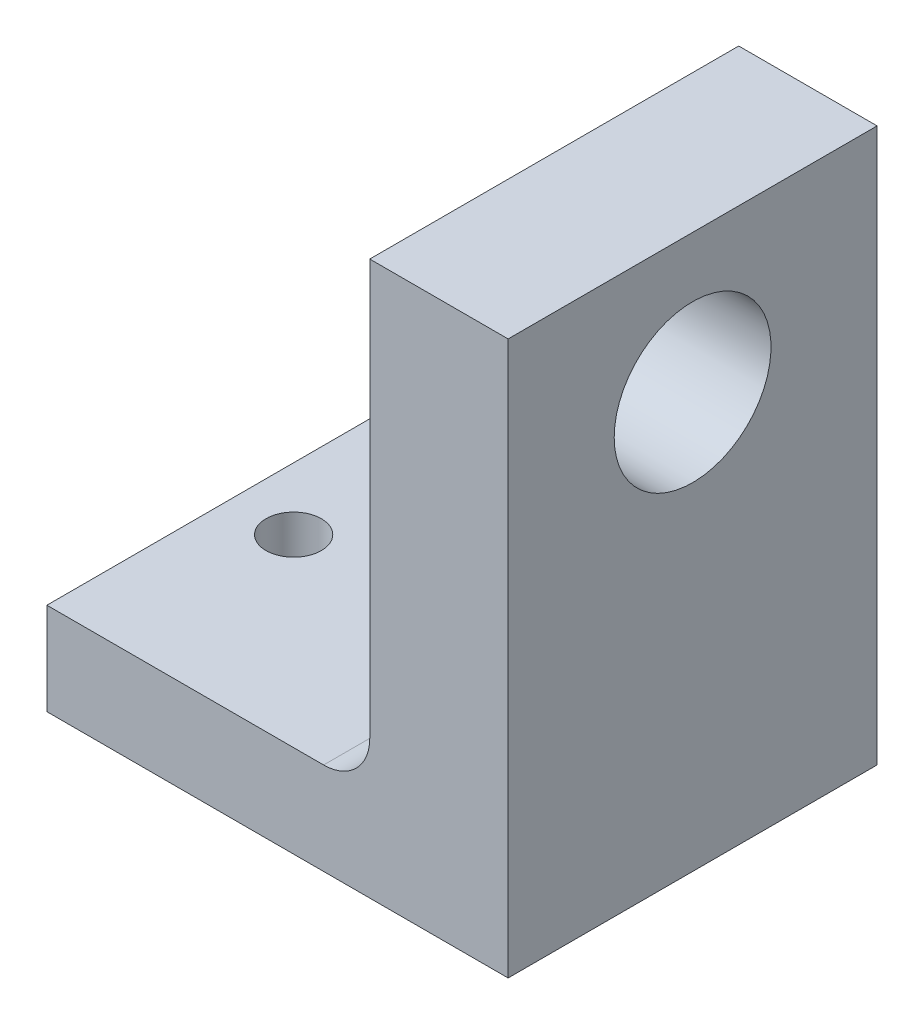
from build123d import *

# Parameters (mm, degrees)
EXTRUDE_1_DEPTH     = 8
SKETCH_2_R          = 0.6
CUT_EXTRUDE_1_DEPTH = 14.747727085
HOLE_WIZARD_M3_1_D  = 3.4
FILLET_1_R          = 1


with BuildPart() as part:
    # ｽｹｯﾁ1 → ﾎﾞｽ - 押し出し1 (new body)
    with BuildSketch(Plane.XY):
        Polygon((-5, -6), (5, -6), (5, 6), (2, 6), (2, -4), (-5, -4), align=None)
    extrude(amount=EXTRUDE_1_DEPTH)

    # ｽｹｯﾁ2 → ｶｯﾄ - 押し出し1 (cut, through all)
    with BuildSketch(Plane(origin=(0, -4, 0), x_dir=(1, 0, 0), z_dir=(0, 1, 0))):
        with Locations(Location((-1.11, -4, 0), (0, 0, 180))):
            Circle(SKETCH_2_R)
        with Locations(Location((-3.65, -4, 0), (0, 0, 180))):
            Circle(SKETCH_2_R)
    extrude(amount=-CUT_EXTRUDE_1_DEPTH, mode=Mode.SUBTRACT)

    # M3 すきま穴1 (through all)
    with Locations(Plane.ZY.offset(-2)):
        with Locations((4, 3)):
            Hole(HOLE_WIZARD_M3_1_D / 2)

    # ﾌｨﾚｯﾄ1
    fillet_1_edges = [part.edges().sort_by_distance(p)[0] for p in [
        (2, -4, 4),
    ]]
    fillet(fillet_1_edges, radius=FILLET_1_R)


solid = part.part
